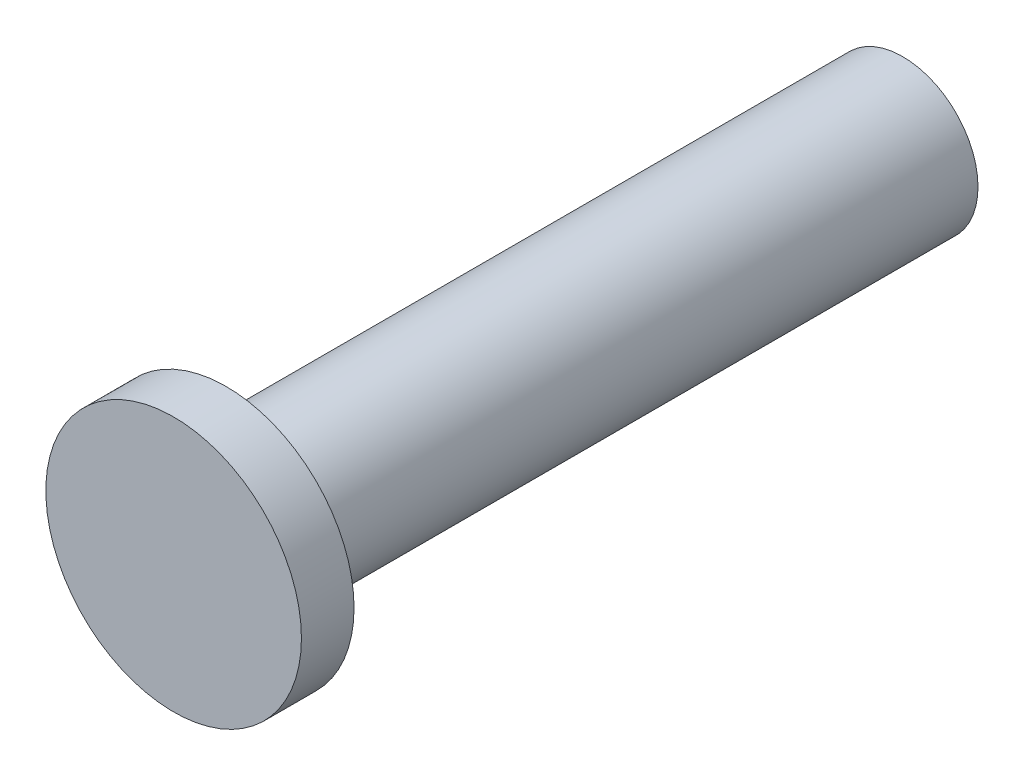
from build123d import *

# Parameters (mm, degrees)
THREAD_ENVELOPE_START = -9
SKETCH1_R             = 1
THREAD_ENVELOPE_DEPTH = 9
SKETCH2_R             = 1.7
HEAD_ENVELOPE_DEPTH   = 0.7


with BuildPart() as part:
    # Sketch1 → Thread_Envelope (new body)
    with BuildSketch(Plane.XY.offset(THREAD_ENVELOPE_START)):
        Circle(SKETCH1_R)
    extrude(amount=THREAD_ENVELOPE_DEPTH)

    # Sketch2 → Head_Envelope (add)
    with BuildSketch(Plane.XY):
        Circle(SKETCH2_R)
    extrude(amount=HEAD_ENVELOPE_DEPTH)


solid = part.part
